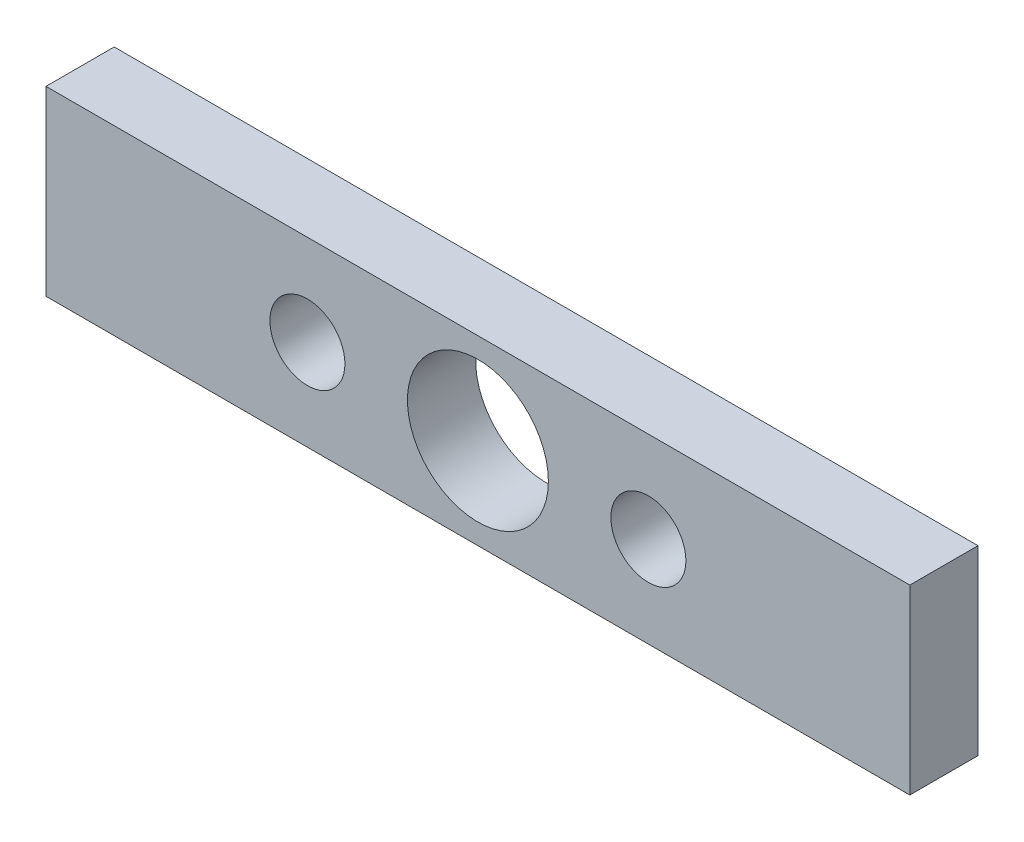
from build123d import *

# Parameters (mm, degrees)
SKETCH1_W           = 38
SKETCH1_H           = 8
BOSS_EXTRUDE1_DEPTH = 3
SKETCH2_R           = 3.1
SKETCH2_R_2         = 1.65
CUT_EXTRUDE1_DEPTH  = 21.832666656


with BuildPart() as part:
    # Sketch1 → Boss-Extrude1 (new body)
    with BuildSketch(Plane.XY):
        with Locations((0, 4)):
            Rectangle(SKETCH1_W, SKETCH1_H)
    extrude(amount=BOSS_EXTRUDE1_DEPTH)

    # Sketch2 → Cut-Extrude1 (cut, through all)
    with BuildSketch(Plane.XY.offset(3)):
        with Locations((0, 4)):
            Circle(SKETCH2_R)
        with Locations((-7.5, 4)):
            Circle(SKETCH2_R_2)
        with Locations((7.5, 4)):
            Circle(SKETCH2_R_2)
    extrude(amount=-CUT_EXTRUDE1_DEPTH, mode=Mode.SUBTRACT)


solid = part.part
